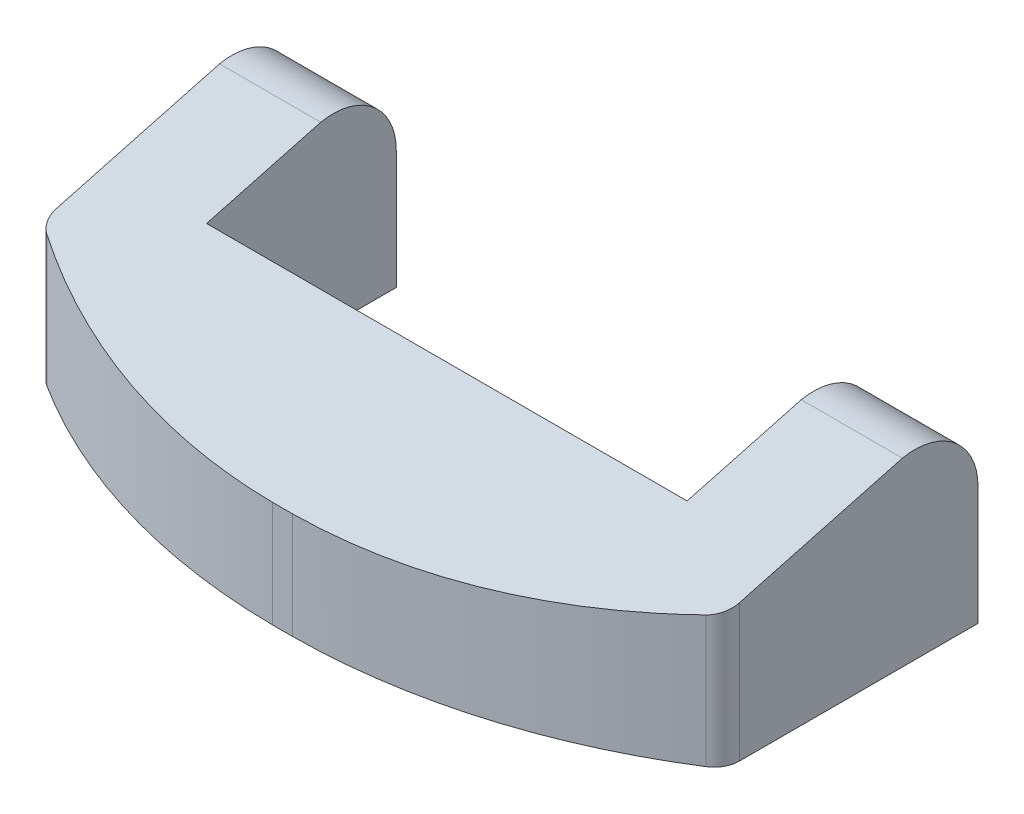
from build123d import *

# Parameters (mm, degrees)
BOSS_EXTRUDE1_DEPTH      = 70
BOSS_EXTRUDE1_DEPTH_BACK = 2
SKETCH1_W                = 270
SKETCH1_H                = 110
CUT_EXTRUDE3_DEPTH       = 331
SKETCH18_W               = 270
SKETCH18_H               = 72
BOSS_EXTRUDE3_DEPTH      = 30
CUT_EXTRUDE16_DEPTH      = 292.590466236
CUT_EXTRUDE16_DEPTH_BACK = 292.590466236
CUT_EXTRUDE17_DEPTH      = 176.025712397
CUT_EXTRUDE17_DEPTH_BACK = 176.025712397


with BuildPart() as part:
    # Sketch1 → Boss-Extrude1 (new, two sides: drawn at the far end of the back side and taken through both)
    with BuildSketch(Plane(origin=(0, 0, 0), x_dir=(1, 0, 0), z_dir=(0, 1, 0)).offset(-BOSS_EXTRUDE1_DEPTH_BACK)):
        Rectangle(SKETCH1_W, SKETCH1_H)
    extrude(amount=BOSS_EXTRUDE1_DEPTH + BOSS_EXTRUDE1_DEPTH_BACK)

    # Sketch2 → Cut-Extrude3 (cut)
    with BuildSketch(Plane(origin=(0, 70, 0), x_dir=(1, 0, 0), z_dir=(0, 1, 0))):
        Polygon((-95, 55), (-95, -20), (0, -20), (95, -20), (95, 55), align=None)
    extrude(amount=-CUT_EXTRUDE3_DEPTH, mode=Mode.SUBTRACT)

    # Sketch18 → Boss-Extrude3 (add)
    with BuildSketch(Plane.XY.offset(55)):
        with Locations((0, 34)):
            Rectangle(SKETCH18_W, SKETCH18_H)
    extrude(amount=BOSS_EXTRUDE3_DEPTH)

    # Sketch19 → Cut-Extrude16 (cut, two sides: drawn at the far end of the back side and taken through both)
    with BuildSketch(Plane(origin=(135, 0, 0), x_dir=(0, 0, -1), z_dir=(1, 0, 0)).offset(-CUT_EXTRUDE16_DEPTH_BACK)):
        with BuildLine():
            Line((-379.944046873, -39.064261373), (-85, 40))
            Line((-85, 40), (25.116182189, 69.51832628))
            ThreePointArc((25.116182189, 69.51832628), (45.85724684, 64.327382716), (55, 45))
            Line((55, 45), (55, -260.357410606))
            Line((55, -260.357410606), (331.938852434, 283.956345293))
            Line((331.938852434, 283.956345293), (-103.005194439, 505.249494526))
            Line((-103.005194439, 505.249494526), (-379.944046873, -39.064261373))
        make_face()
    extrude(amount=CUT_EXTRUDE16_DEPTH + CUT_EXTRUDE16_DEPTH_BACK, mode=Mode.SUBTRACT)

    # Sketch21 → Cut-Extrude17 (cut, two sides: drawn at the far end of the back side and taken through both)
    with BuildSketch(Plane.XZ.offset(2).offset(-CUT_EXTRUDE17_DEPTH_BACK)):
        with BuildLine():
            ThreePointArc((3.953760881, 85), (69.754776005, 75.238802072), (130.348831285, 47.79039518))
            ThreePointArc((130.348831285, 47.79039518), (133.760374217, 44.16356592), (135, 39.341134628))
            Line((135, 39.341134628), (135, 85))
            Line((135, 85), (3.953760881, 85))
        make_face()
        with BuildLine():
            ThreePointArc((-130.348831285, 47.79039518), (-69.754776005, 75.238802072), (-3.953760881, 85))
            Line((-3.953760881, 85), (-135, 85))
            Line((-135, 85), (-135, 39.341134628))
            ThreePointArc((-135, 39.341134628), (-133.760374217, 44.16356592), (-130.348831285, 47.79039518))
        make_face()
    extrude(amount=CUT_EXTRUDE17_DEPTH + CUT_EXTRUDE17_DEPTH_BACK, mode=Mode.SUBTRACT)


solid = part.part
